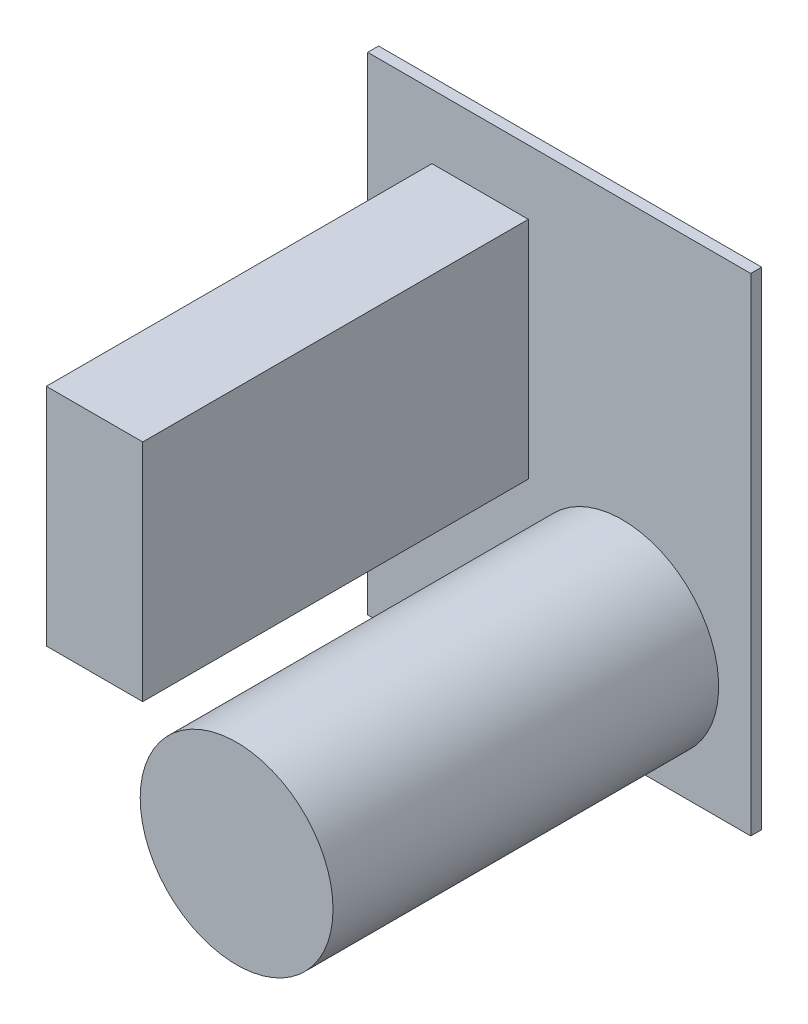
from build123d import *

# Parameters (mm, degrees)
ESBO_O1_W                = 59.6
ESBO_O1_H                = 75.8
RESSALTO_EXTRUS_O1_DEPTH = 1.7
ESBO_O2_W                = 15
ESBO_O2_H                = 35
RESSALTO_EXTRUS_O2_DEPTH = 60
ESBO_O5_R                = 15
RESSALTO_EXTRUS_O4_DEPTH = 60


with BuildPart() as part:
    # Esboço1 → Ressalto-extrusão1 (new body)
    with BuildSketch(Plane.XY):
        with Locations((29.8, 37.9)):
            Rectangle(ESBO_O1_W, ESBO_O1_H)
    extrude(amount=RESSALTO_EXTRUS_O1_DEPTH)

    # Esboço2 → Ressalto-extrusão2 (add)
    with BuildSketch(Plane.XY.offset(1.7)):
        with Locations((17.5, 48.3)):
            Rectangle(ESBO_O2_W, ESBO_O2_H)
    extrude(amount=RESSALTO_EXTRUS_O2_DEPTH)

    # Esboço5 → Ressalto-extrusão4 (add)
    with BuildSketch(Plane.XY.offset(1.7)):
        with Locations(Location((39.605292245, 17.63947517, 0), (0, 0, 180))):
            Circle(ESBO_O5_R)
    extrude(amount=RESSALTO_EXTRUS_O4_DEPTH)


solid = part.part
